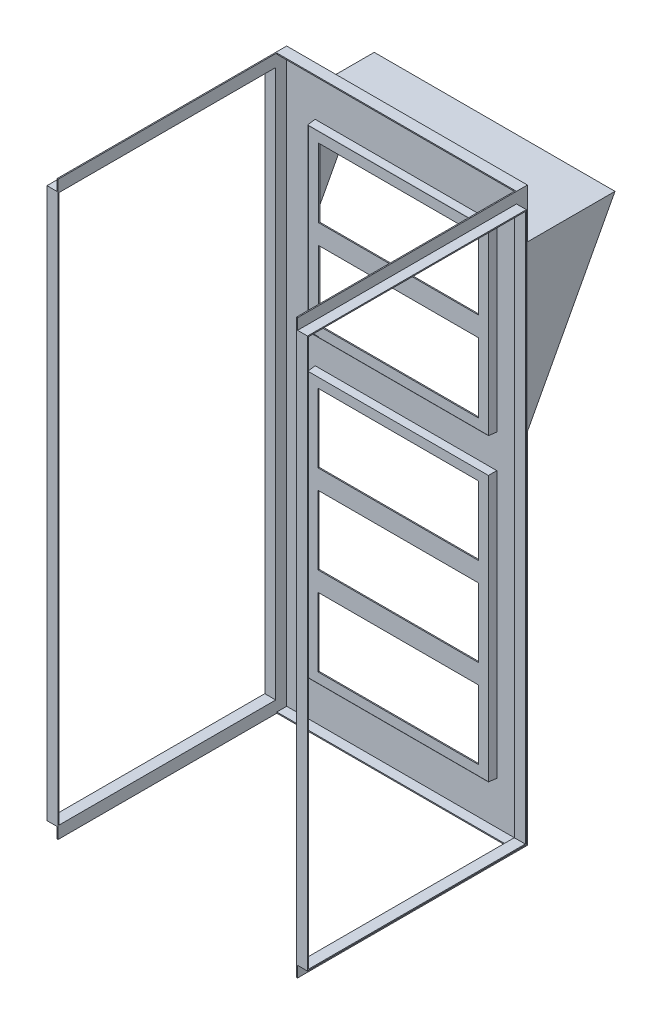
from build123d import *

# Parameters (mm, degrees)
SKETCH_1_W          = 44
SKETCH_1_H          = 104.5
EXTRUDE_1_DEPTH     = 2
SHELL_1_T           = -0.2
SKETCH_2_W          = 32.8
SKETCH_2_H          = 32.5
SKETCH_2_H_2        = 48.3
CUT_EXTRUDE_1_DEPTH = 2
SKETCH_3_W          = 33.2
SKETCH_3_H          = 32.9
SKETCH_3_W_2        = 32.8
SKETCH_3_H_2        = 32.5
SKETCH_3_H_3        = 48.7
SKETCH_3_H_4        = 48.3
EXTRUDE_2_DEPTH     = 1.8
EXTRUDE_2_TAPER     = 4
SKETCH_6_W          = 29.2
SKETCH_6_H          = 12.7
SKETCH_6_H_2        = 12.6
EXTRUDE_3_DEPTH     = 0.2
SKETCH_7_W          = 33
SKETCH_7_H          = 48.5
SKETCH_7_W_2        = 29.3
SKETCH_7_H_2        = 12.6
EXTRUDE_4_DEPTH     = 0.2
EXTRUDE_6_DEPTH     = 44
SKETCH_12_W         = 43.6
SKETCH_12_H         = 29.8
CUT_EXTRUDE_5_DEPTH = 16
SKETCH_13_W         = 40
SKETCH_13_H         = 100.5
SKETCH_13_W_2       = 39.6
SKETCH_13_H_2       = 100.1
EXTRUDE_7_DEPTH     = 2
SKETCH_15_W         = 40
SKETCH_15_H         = 100.5
SKETCH_15_W_2       = 39.6
SKETCH_15_H_2       = 100.1
EXTRUDE_8_DEPTH     = 2
SKETCH_16_W         = 0.2
SKETCH_16_H         = 2
EXTRUDE_9_DEPTH     = 40


with BuildPart() as part:
    # 스케치1 → 보스-돌출1 (new body)
    with BuildSketch(Plane.XY):
        with Locations((22, 52.25)):
            Rectangle(SKETCH_1_W, SKETCH_1_H)
    extrude(amount=EXTRUDE_1_DEPTH)

    # 쉘1
    shell_1_openings = [part.faces().sort_by_distance(p)[0] for p in [
        (22, 52.25, 2),
    ]]
    offset(amount=SHELL_1_T, openings=shell_1_openings, kind=Kind.INTERSECTION)

    # 스케치2 → 컷-돌출1 (cut)
    with BuildSketch(Plane.XY.offset(0.2)):
        with Locations((22, 79.25)):
            Rectangle(SKETCH_2_W, SKETCH_2_H)
        with Locations((22, 32.35)):
            Rectangle(SKETCH_2_W, SKETCH_2_H_2)
    extrude(amount=-CUT_EXTRUDE_1_DEPTH, mode=Mode.SUBTRACT)

    # 스케치3 → 보스-돌출2 (add)
    # profile 1 of 2: a face of its own
    with BuildSketch(Plane.XY.offset(0.2)):
        with Locations((22, 79.25)):
            Rectangle(SKETCH_3_W, SKETCH_3_H)
        with Locations((22, 79.25)):
            Rectangle(SKETCH_3_W_2, SKETCH_3_H_2, mode=Mode.SUBTRACT)
    # profile 2 of 2: a face of its own
    with BuildSketch(Plane.XY.offset(0.2)):
        with Locations((22, 32.35)):
            Rectangle(SKETCH_3_W, SKETCH_3_H_3)
        with Locations((22, 32.35)):
            Rectangle(SKETCH_3_W_2, SKETCH_3_H_4, mode=Mode.SUBTRACT)
    extrude(amount=EXTRUDE_2_DEPTH, taper=EXTRUDE_2_TAPER)

    # 스케치7 → 보스-돌출4 (add)
    with BuildSketch(Plane.XY.offset(1.4)):
        with Locations((22, 32.35)):
            Rectangle(SKETCH_7_W, SKETCH_7_H)
        with Locations((22, 16.2)):
            Rectangle(SKETCH_7_W_2, SKETCH_7_H_2, mode=Mode.SUBTRACT)
        with Locations((22, 32.35)):
            Rectangle(SKETCH_7_W_2, SKETCH_7_H_2, mode=Mode.SUBTRACT)
        with Locations((22, 48.5)):
            Rectangle(SKETCH_7_W_2, SKETCH_7_H_2, mode=Mode.SUBTRACT)
    extrude(amount=EXTRUDE_4_DEPTH)

    # 스케치13 → 보스-돌출7 (add)
    with BuildSketch(Plane.ZY.offset(-43.8)):
        with Locations((22, 52.25)):
            Rectangle(SKETCH_13_W, SKETCH_13_H)
        with Locations((22, 52.25)):
            Rectangle(SKETCH_13_W_2, SKETCH_13_H_2, mode=Mode.SUBTRACT)
    extrude(amount=-EXTRUDE_7_DEPTH)

    # 스케치15 → 보스-돌출8 (add)
    with BuildSketch(Plane(origin=(0.2, 0, 0), x_dir=(0, 0, -1), z_dir=(1, 0, 0))):
        with Locations((-22, 52.25)):
            Rectangle(SKETCH_15_W, SKETCH_15_H)
        with Locations((-22, 52.25)):
            Rectangle(SKETCH_15_W_2, SKETCH_15_H_2, mode=Mode.SUBTRACT)
    extrude(amount=-EXTRUDE_8_DEPTH)

    # 스케치16 → 보스-돌출9 (add)
    with BuildSketch(Plane.XY.offset(2)):
        with Locations((43.9, 103.5)):
            Rectangle(SKETCH_16_W, SKETCH_16_H)
        with Locations((43.9, 1)):
            Rectangle(SKETCH_16_W, SKETCH_16_H)
        with Locations((0.1, 1)):
            Rectangle(SKETCH_16_W, SKETCH_16_H)
        with Locations((0.1, 103.5)):
            Rectangle(SKETCH_16_W, SKETCH_16_H)
    extrude(amount=EXTRUDE_9_DEPTH)


with BuildPart() as body_2:
    # 스케치6 → 보스-돌출3 (new body)
    with BuildSketch(Plane.XY.offset(1.4)):
        Polygon((5.6, 95.5), (5.6, 63), (7.45, 63), (7.45, 62.9), (38.5, 62.9), (38.5, 95.6), (36.65, 95.6), (36.65, 95.5), align=None)
        with Locations((22.05, 71.1)):
            Rectangle(SKETCH_6_W, SKETCH_6_H, mode=Mode.SUBTRACT)
        with Locations((22.05, 87.35)):
            Rectangle(SKETCH_6_W, SKETCH_6_H_2, mode=Mode.SUBTRACT)
    extrude(amount=EXTRUDE_3_DEPTH)


with BuildPart() as body_3:
    # 스케치11 → 보스-돌출6 (new body)
    with BuildSketch(Plane.ZY):
        Polygon((0, 95.5), (-16, 95.5), (0, 65.5), align=None)
    extrude(amount=-EXTRUDE_6_DEPTH)

    # 스케치12 → 컷-돌출5 (cut)
    with BuildSketch(Plane(origin=(0, 0, 0), x_dir=(-1, 0, 0), z_dir=(0, 0, -1))):
        with Locations((-22, 80.4)):
            Rectangle(SKETCH_12_W, SKETCH_12_H)
    extrude(amount=CUT_EXTRUDE_5_DEPTH, mode=Mode.SUBTRACT)


solid = Compound([part.part, body_2.part, body_3.part])
